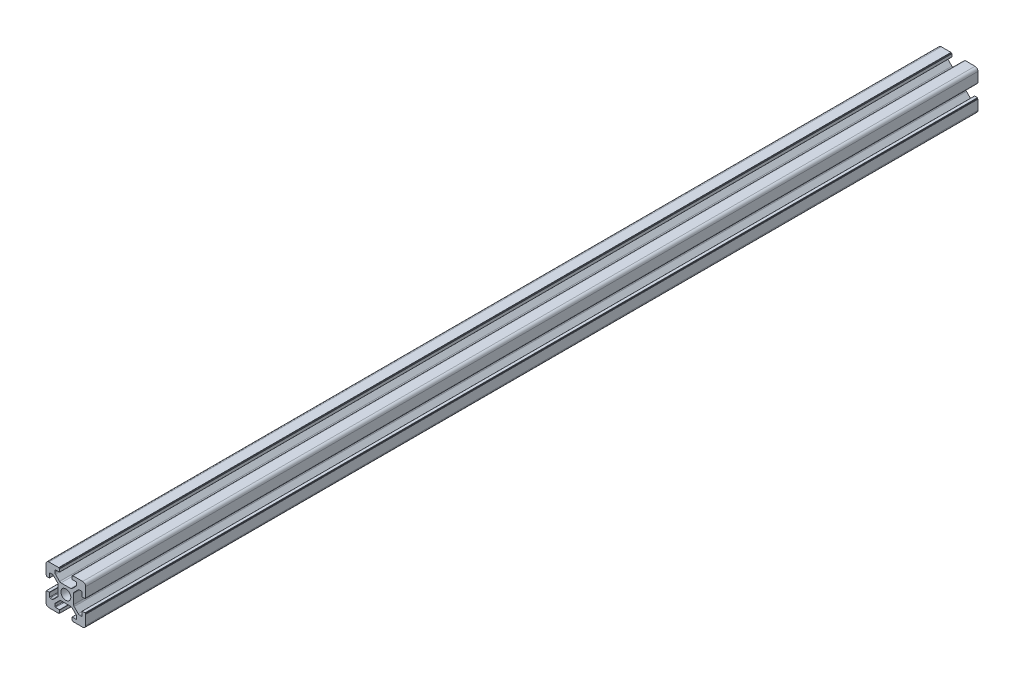
from build123d import *

# Parameters (mm, degrees)
SKETCH_1_R      = 2.5
EXTRUDE_1_DEPTH = 450
FILLET_1_R      = 1.5


with BuildPart() as part:
    # 草图1 → 凸台-拉伸1 (new body)
    with BuildSketch(Plane.XY):
        with BuildLine():
            Line((20, 13.6), (20, 20))
            Line((20, 20), (13.6, 20))
            Line((13.6, 20), (13.6, 19.8))
            Line((13.6, 19.8), (13.2, 19.8))
            ThreePointArc((13.2, 19.8), (13.129289322, 19.770710678), (13.1, 19.7))
            Line((13.1, 19.7), (13.1, 18.3))
            ThreePointArc((13.1, 18.3), (13.129289322, 18.229289322), (13.2, 18.2))
            Line((13.2, 18.2), (15.2, 18.2))
            ThreePointArc((15.2, 18.2), (15.412132034, 18.112132034), (15.5, 17.9))
            Line((15.5, 17.9), (15.5, 16.974873734))
            ThreePointArc((15.5, 16.974873734), (15.423879533, 16.592190302), (15.207106781, 16.267766953))
            Line((15.207106781, 16.267766953), (13.132233047, 14.192893219))
            ThreePointArc((13.132233047, 14.192893219), (12.807809698, 13.976120467), (12.425126266, 13.9))
            Line((12.425126266, 13.9), (7.574873734, 13.9))
            ThreePointArc((7.574873734, 13.9), (7.192190302, 13.976120467), (6.867766953, 14.192893219))
            Line((6.867766953, 14.192893219), (4.792893219, 16.267766953))
            ThreePointArc((4.792893219, 16.267766953), (4.576120467, 16.592190302), (4.5, 16.974873734))
            Line((4.5, 16.974873734), (4.5, 17.9))
            ThreePointArc((4.5, 17.9), (4.587867966, 18.112132034), (4.8, 18.2))
            Line((4.8, 18.2), (6.8, 18.2))
            ThreePointArc((6.8, 18.2), (6.870710678, 18.229289322), (6.9, 18.3))
            Line((6.9, 18.3), (6.9, 19.7))
            ThreePointArc((6.9, 19.7), (6.870710678, 19.770710678), (6.8, 19.8))
            Line((6.8, 19.8), (6.4, 19.8))
            Line((6.4, 19.8), (6.4, 20))
            Line((6.4, 20), (0, 20))
            Line((0, 20), (0, 13.6))
            Line((0, 13.6), (0.2, 13.6))
            Line((0.2, 13.6), (0.2, 13.2))
            ThreePointArc((0.2, 13.2), (0.229289322, 13.129289322), (0.3, 13.1))
            Line((0.3, 13.1), (1.7, 13.1))
            ThreePointArc((1.7, 13.1), (1.770710678, 13.129289322), (1.8, 13.2))
            Line((1.8, 13.2), (1.8, 15.2))
            ThreePointArc((1.8, 15.2), (1.887867966, 15.412132034), (2.1, 15.5))
            Line((2.1, 15.5), (3.025126266, 15.5))
            ThreePointArc((3.025126266, 15.5), (3.407809698, 15.423879533), (3.732233047, 15.207106781))
            Line((3.732233047, 15.207106781), (5.807106781, 13.132233047))
            ThreePointArc((5.807106781, 13.132233047), (6.023879533, 12.807809698), (6.1, 12.425126266))
            Line((6.1, 12.425126266), (6.1, 7.574873734))
            ThreePointArc((6.1, 7.574873734), (6.023879533, 7.192190302), (5.807106781, 6.867766953))
            Line((5.807106781, 6.867766953), (3.732233047, 4.792893219))
            ThreePointArc((3.732233047, 4.792893219), (3.407809698, 4.576120467), (3.025126266, 4.5))
            Line((3.025126266, 4.5), (2.1, 4.5))
            ThreePointArc((2.1, 4.5), (1.887867966, 4.587867966), (1.8, 4.8))
            Line((1.8, 4.8), (1.8, 6.8))
            ThreePointArc((1.8, 6.8), (1.770710678, 6.870710678), (1.7, 6.9))
            Line((1.7, 6.9), (0.3, 6.9))
            ThreePointArc((0.3, 6.9), (0.229289322, 6.870710678), (0.2, 6.8))
            Line((0.2, 6.8), (0.2, 6.4))
            Line((0.2, 6.4), (0, 6.4))
            Line((0, 6.4), (0, 0))
            Line((0, 0), (6.4, 0))
            Line((6.4, 0), (6.4, 0.2))
            Line((6.4, 0.2), (6.8, 0.2))
            ThreePointArc((6.8, 0.2), (6.870710678, 0.229289322), (6.9, 0.3))
            Line((6.9, 0.3), (6.9, 1.7))
            ThreePointArc((6.9, 1.7), (6.870710678, 1.770710678), (6.8, 1.8))
            Line((6.8, 1.8), (4.8, 1.8))
            ThreePointArc((4.8, 1.8), (4.587867966, 1.887867966), (4.5, 2.1))
            Line((4.5, 2.1), (4.5, 3.025126266))
            ThreePointArc((4.5, 3.025126266), (4.576120467, 3.407809698), (4.792893219, 3.732233047))
            Line((4.792893219, 3.732233047), (6.867766953, 5.807106781))
            ThreePointArc((6.867766953, 5.807106781), (7.192190302, 6.023879533), (7.574873734, 6.1))
            Line((7.574873734, 6.1), (12.425126266, 6.1))
            ThreePointArc((12.425126266, 6.1), (12.807809698, 6.023879533), (13.132233047, 5.807106781))
            Line((13.132233047, 5.807106781), (15.207106781, 3.732233047))
            ThreePointArc((15.207106781, 3.732233047), (15.423879533, 3.407809698), (15.5, 3.025126266))
            Line((15.5, 3.025126266), (15.5, 2.1))
            ThreePointArc((15.5, 2.1), (15.412132034, 1.887867966), (15.2, 1.8))
            Line((15.2, 1.8), (13.2, 1.8))
            ThreePointArc((13.2, 1.8), (13.129289322, 1.770710678), (13.1, 1.7))
            Line((13.1, 1.7), (13.1, 0.3))
            ThreePointArc((13.1, 0.3), (13.129289322, 0.229289322), (13.2, 0.2))
            Line((13.2, 0.2), (13.6, 0.2))
            Line((13.6, 0.2), (13.6, 0))
            Line((13.6, 0), (20, 0))
            Line((20, 0), (20, 6.4))
            Line((20, 6.4), (19.8, 6.4))
            Line((19.8, 6.4), (19.8, 6.8))
            ThreePointArc((19.8, 6.8), (19.770710678, 6.870710678), (19.7, 6.9))
            Line((19.7, 6.9), (18.3, 6.9))
            ThreePointArc((18.3, 6.9), (18.229289322, 6.870710678), (18.2, 6.8))
            Line((18.2, 6.8), (18.2, 4.8))
            ThreePointArc((18.2, 4.8), (18.112132034, 4.587867966), (17.9, 4.5))
            Line((17.9, 4.5), (16.974873734, 4.5))
            ThreePointArc((16.974873734, 4.5), (16.592190302, 4.576120467), (16.267766953, 4.792893219))
            Line((16.267766953, 4.792893219), (14.192893219, 6.867766953))
            ThreePointArc((14.192893219, 6.867766953), (13.976120467, 7.192190302), (13.9, 7.574873734))
            Line((13.9, 7.574873734), (13.9, 12.425126266))
            ThreePointArc((13.9, 12.425126266), (13.976120467, 12.807809698), (14.192893219, 13.132233047))
            Line((14.192893219, 13.132233047), (16.267766953, 15.207106781))
            ThreePointArc((16.267766953, 15.207106781), (16.592190302, 15.423879533), (16.974873734, 15.5))
            Line((16.974873734, 15.5), (17.9, 15.5))
            ThreePointArc((17.9, 15.5), (18.112132034, 15.412132034), (18.2, 15.2))
            Line((18.2, 15.2), (18.2, 13.2))
            ThreePointArc((18.2, 13.2), (18.229289322, 13.129289322), (18.3, 13.1))
            Line((18.3, 13.1), (19.7, 13.1))
            ThreePointArc((19.7, 13.1), (19.770710678, 13.129289322), (19.8, 13.2))
            Line((19.8, 13.2), (19.8, 13.6))
            Line((19.8, 13.6), (20, 13.6))
        make_face()
        with Locations((10, 10)):
            Circle(SKETCH_1_R, mode=Mode.SUBTRACT)
    extrude(amount=EXTRUDE_1_DEPTH)

    # 圆角1
    fillet_1_edges = [part.edges().sort_by_distance(p)[0] for p in [
        (0, 0, 225),
        (0, 20, 225),
        (20, 20, 225),
        (20, 0, 225),
    ]]
    fillet(fillet_1_edges, radius=FILLET_1_R)


solid = part.part
